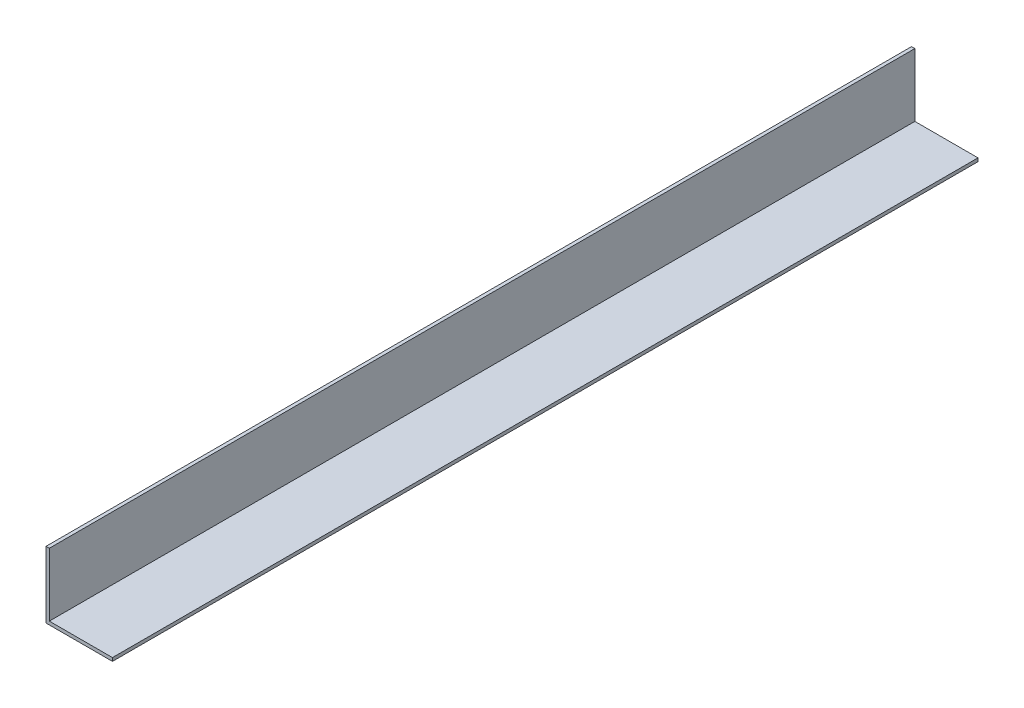
from build123d import *

# Parameters (mm, degrees)
BOSS_EXTRUDE1_DEPTH = 521


with BuildPart() as part:
    # Sketch1 → Boss-Extrude1 (new body)
    with BuildSketch(Plane.XY):
        Polygon((0, 0), (0, 40), (2, 40), (2, 2), (40, 2), (40, 0), align=None)
    extrude(amount=BOSS_EXTRUDE1_DEPTH)


solid = part.part
